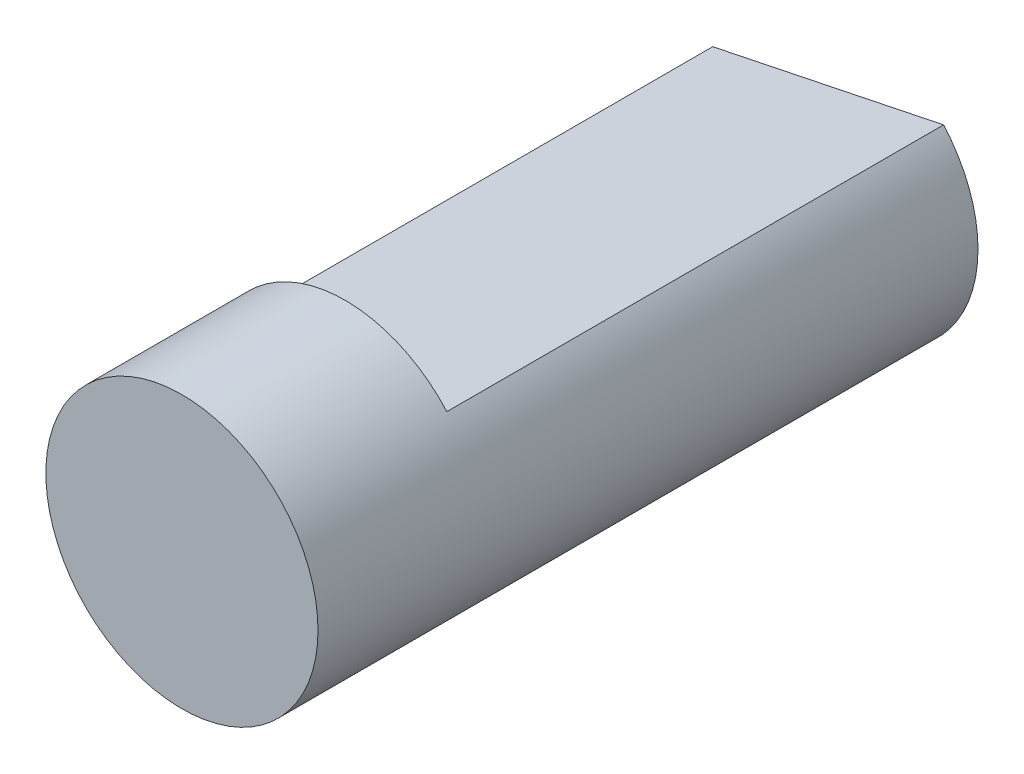
from build123d import *

# Parameters (mm, degrees)
SKETCH_1_R      = 2
EXTRUDE_1_DEPTH = 2.4
EXTRUDE_2_DEPTH = 7.3


with BuildPart() as part:
    # 草图1 → 凸台-拉伸1 (new body)
    with BuildSketch(Plane.XY):
        Circle(SKETCH_1_R)
    extrude(amount=-EXTRUDE_1_DEPTH)

    # 草图2 → 凸台-拉伸2 (add)
    with BuildSketch(Plane(origin=(0, 0, -2.4), x_dir=(-1, 0, 0), z_dir=(0, 0, -1))):
        with BuildLine():
            ThreePointArc((2, 0), (1.974474181, 0.318514847), (1.898548292, 0.628899341))
            Line((1.898548292, 0.628899341), (-1.493916952, 1.329741381))
            ThreePointArc((-1.493916952, 1.329741381), (-0.711395142, -1.869202223), (2, 0))
        make_face()
    extrude(amount=EXTRUDE_2_DEPTH)


solid = part.part
